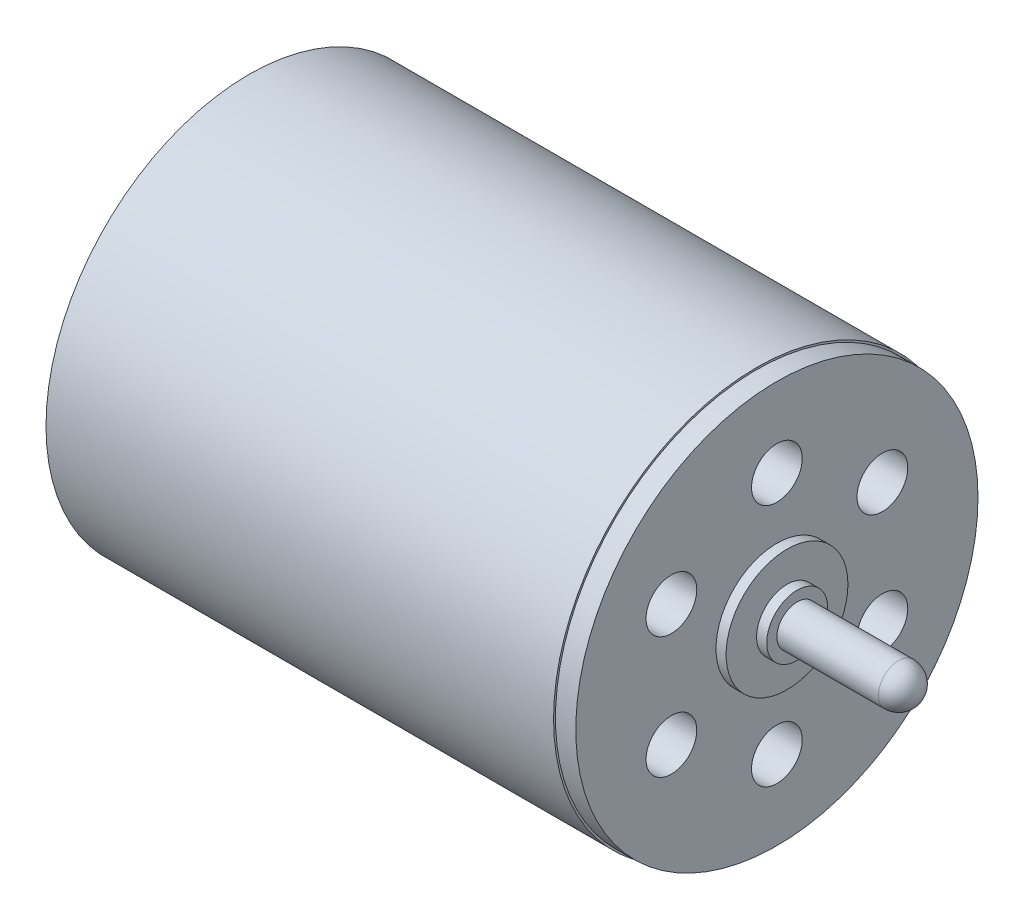
from build123d import *

# Parameters (mm, degrees)
CROQUIS4_R              = 10
SALIENTE_EXTRUIR2_DEPTH = 25
CROQUIS5_R              = 3
SALIENTE_EXTRUIR3_DEPTH = 1.5
CROQUIS6_R              = 1.5
SALIENTE_EXTRUIR4_DEPTH = 0.5
CROQUIS7_R              = 1
SALIENTE_EXTRUIR5_DEPTH = 6
REDONDEO1_R             = 1
CROQUIS10_R             = 9.905946753
SALIENTE_EXTRUIR6_DEPTH = 1
CORTAR_EXTRUIR1_START   = 1
CROQUIS8_R              = 1.25
CORTAR_EXTRUIR1_DEPTH   = 6


with BuildPart() as part:
    # Croquis4 → Saliente-Extruir2 (new body)
    with BuildSketch(Plane(origin=(0, 0, 0), x_dir=(0, 0, -1), z_dir=(1, 0, 0))):
        Circle(CROQUIS4_R)
    extrude(amount=SALIENTE_EXTRUIR2_DEPTH)

    # Croquis5 → Saliente-Extruir3 (add)
    with BuildSketch(Plane(origin=(25, 0, 0), x_dir=(0, 0, -1), z_dir=(1, 0, 0))):
        Circle(CROQUIS5_R)
    extrude(amount=SALIENTE_EXTRUIR3_DEPTH)

    # Croquis6 → Saliente-Extruir4 (add)
    with BuildSketch(Plane(origin=(26.5, 0, 0), x_dir=(0, 0, -1), z_dir=(1, 0, 0))):
        Circle(CROQUIS6_R)
    extrude(amount=SALIENTE_EXTRUIR4_DEPTH)

    # Croquis7 → Saliente-Extruir5 (add)
    with BuildSketch(Plane(origin=(27, 0, 0), x_dir=(0, 0, -1), z_dir=(1, 0, 0))):
        Circle(CROQUIS7_R)
    extrude(amount=SALIENTE_EXTRUIR5_DEPTH)

    # Redondeo1
    redondeo1_edges = [part.edges().sort_by_distance(p)[0] for p in [
        (33, 0, 1),
    ]]
    fillet(redondeo1_edges, radius=REDONDEO1_R)

    # Croquis10 → Saliente-Extruir6 (add)
    with BuildSketch(Plane(origin=(25, 0, 0), x_dir=(0, 0, -1), z_dir=(1, 0, 0))):
        Circle(CROQUIS10_R)
    extrude(amount=SALIENTE_EXTRUIR6_DEPTH)

    # Croquis8 → Cortar-Extruir1 (cut)
    with BuildSketch(Plane(origin=(25, 0, 0), x_dir=(0, 0, -1), z_dir=(1, 0, 0)).offset(CORTAR_EXTRUIR1_START)):
        with Locations((0, 6)):
            Circle(CROQUIS8_R)
        with Locations((5.196152423, 3)):
            Circle(CROQUIS8_R)
        with Locations((5.196152423, -3)):
            Circle(CROQUIS8_R)
        with Locations((0, -6)):
            Circle(CROQUIS8_R)
        with Locations((-5.196152423, -3)):
            Circle(CROQUIS8_R)
        with Locations((-5.196152423, 3)):
            Circle(CROQUIS8_R)
    extrude(amount=-CORTAR_EXTRUIR1_DEPTH, mode=Mode.SUBTRACT)


solid = part.part
